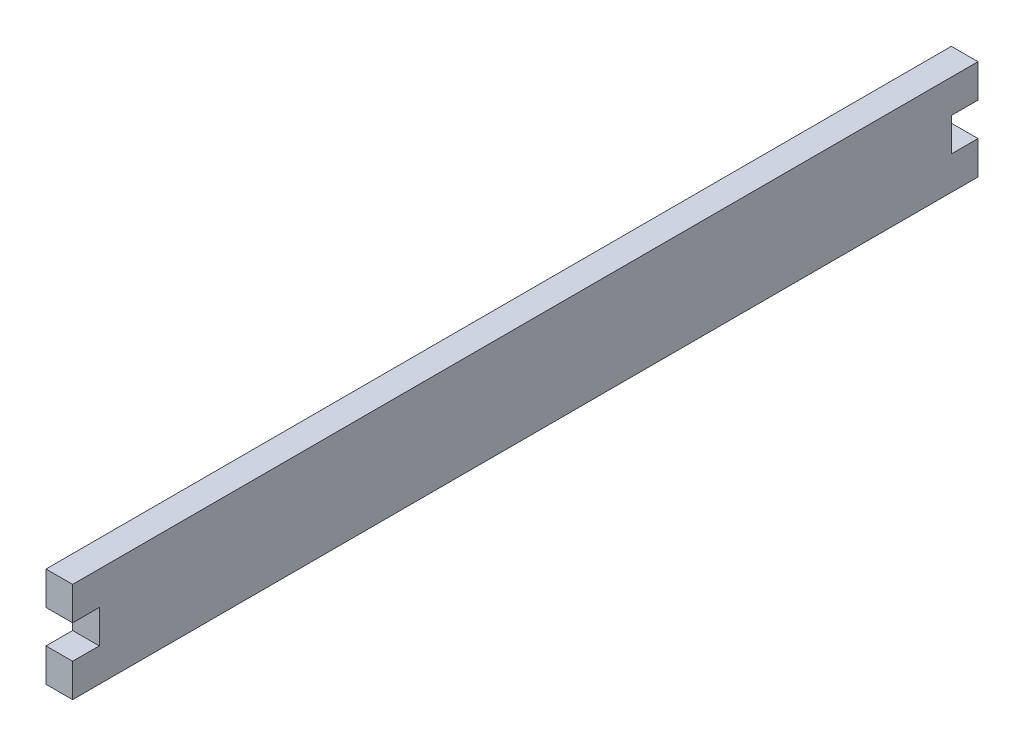
from build123d import *

# Parameters (mm, degrees)
BOSS_EXTRUDE1_DEPTH = 3.175


with BuildPart() as part:
    # Sketch1 → Boss-Extrude1 (new body)
    with BuildSketch(Plane(origin=(0, 0, 0), x_dir=(0, 0, -1), z_dir=(1, 0, 0))):
        Polygon((0, 7.9375), (0, 11.90625), (107.95, 11.90625), (107.95, 7.9375), (104.775, 7.9375), (104.775, 3.96875), (107.95, 3.96875), (107.95, 0), (0, 0), (0, 3.96875), (3.175, 3.96875), (3.175, 7.9375), align=None)
    extrude(amount=BOSS_EXTRUDE1_DEPTH)


solid = part.part
